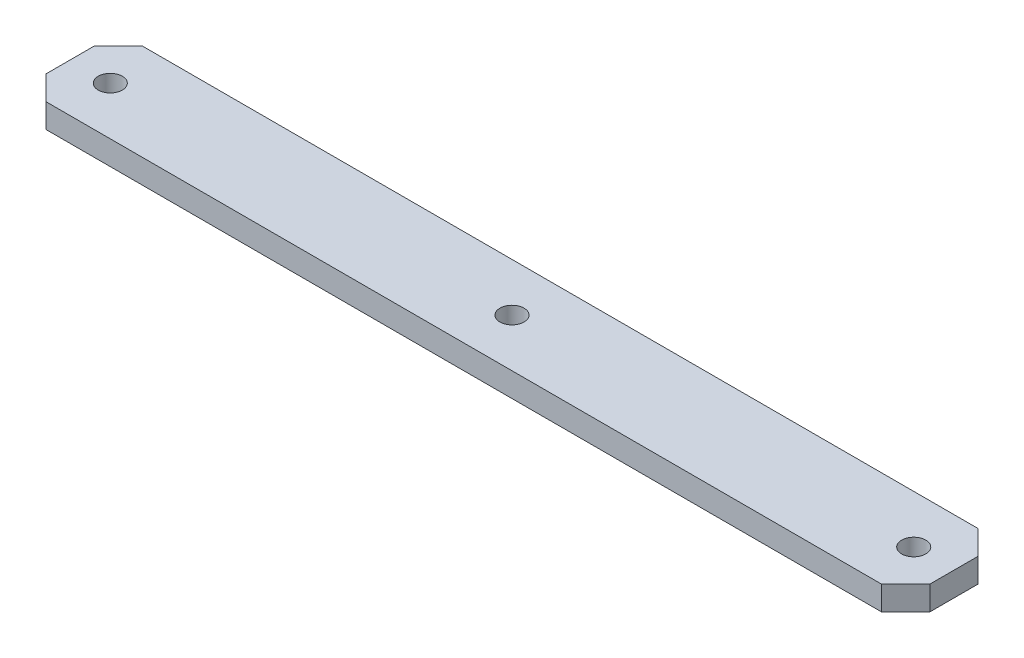
from build123d import *

# Parameters (mm, degrees)
SKETCH1_R           = 1.5
BOSS_EXTRUDE1_DEPTH = 3


with BuildPart() as part:
    # Sketch1 → Boss-Extrude1 (new body)
    with BuildSketch(Plane(origin=(0, 0, 0), x_dir=(1, 0, 0), z_dir=(0, 1, 0))):
        Polygon((-55, 3), (-52, 6), (52, 6), (55, 3), (55, -3), (52, -6), (-52, -6), (-55, -3), align=None)
        with Locations(Location((-50, 0, 0), (0, 0, 270))):
            Circle(SKETCH1_R, mode=Mode.SUBTRACT)
        with Locations(Location((0, 0, 0), (0, 0, 270))):
            Circle(SKETCH1_R, mode=Mode.SUBTRACT)
        with Locations(Location((50, 0, 0), (0, 0, 270))):
            Circle(SKETCH1_R, mode=Mode.SUBTRACT)
    extrude(amount=BOSS_EXTRUDE1_DEPTH)


solid = part.part
